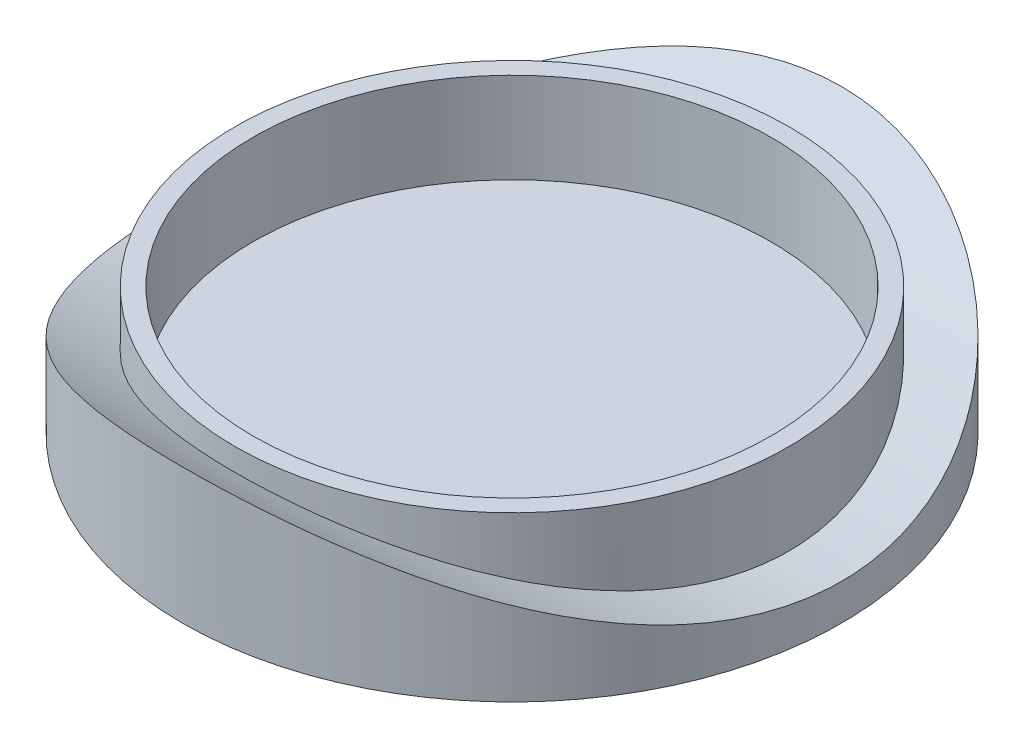
from build123d import *

# Parameters (mm, degrees)
SKETCH_1_R               = 18.2
EXTRUDE_1_DEPTH          = 10
CUT_EXTRUDE_1_DEPTH      = 28.613040398
CUT_EXTRUDE_1_DEPTH_BACK = 28.613040398
SKETCH_3_R               = 33
SKETCH_4_R               = 15.3
EXTRUDE_2_DEPTH          = 7
SKETCH_5_R               = 14.3
CUT_EXTRUDE_2_DEPTH      = 5


with BuildPart() as part:
    # 스케치1 → 보스-돌출1 (new body)
    with BuildSketch(Plane(origin=(0, 0, 0), x_dir=(1, 0, 0), z_dir=(0, 1, 0))):
        with Locations(Location((0, 0, 0), (0, 0, 270))):
            Circle(SKETCH_1_R)
    extrude(amount=EXTRUDE_1_DEPTH)

    # 스케치3 → 컷-돌출1 (cut, two sides: drawn at the far end of the back side and taken through both)
    with BuildSketch(Plane(origin=(0, 0, 0), x_dir=(0, 0, -1), z_dir=(1, 0, 0)).offset(-CUT_EXTRUDE_1_DEPTH_BACK)):
        with Locations((0, 35)):
            Circle(SKETCH_3_R)
    extrude(amount=CUT_EXTRUDE_1_DEPTH + CUT_EXTRUDE_1_DEPTH_BACK, mode=Mode.SUBTRACT)

    # 스케치4 → 보스-돌출2 (add)
    with BuildSketch(Plane(origin=(0, 0, 0), x_dir=(1, 0, 0), z_dir=(0, 1, 0))):
        with Locations(Location((0, 0, 0), (0, 0, 90))):
            Circle(SKETCH_4_R)
    extrude(amount=EXTRUDE_2_DEPTH)

    # 스케치5 → 컷-돌출2 (cut)
    with BuildSketch(Plane(origin=(0, 7, 0), x_dir=(1, 0, 0), z_dir=(0, 1, 0))):
        with Locations(Location((0, 0, 0), (0, 0, 270))):
            Circle(SKETCH_5_R)
    extrude(amount=-CUT_EXTRUDE_2_DEPTH, mode=Mode.SUBTRACT)


solid = part.part
